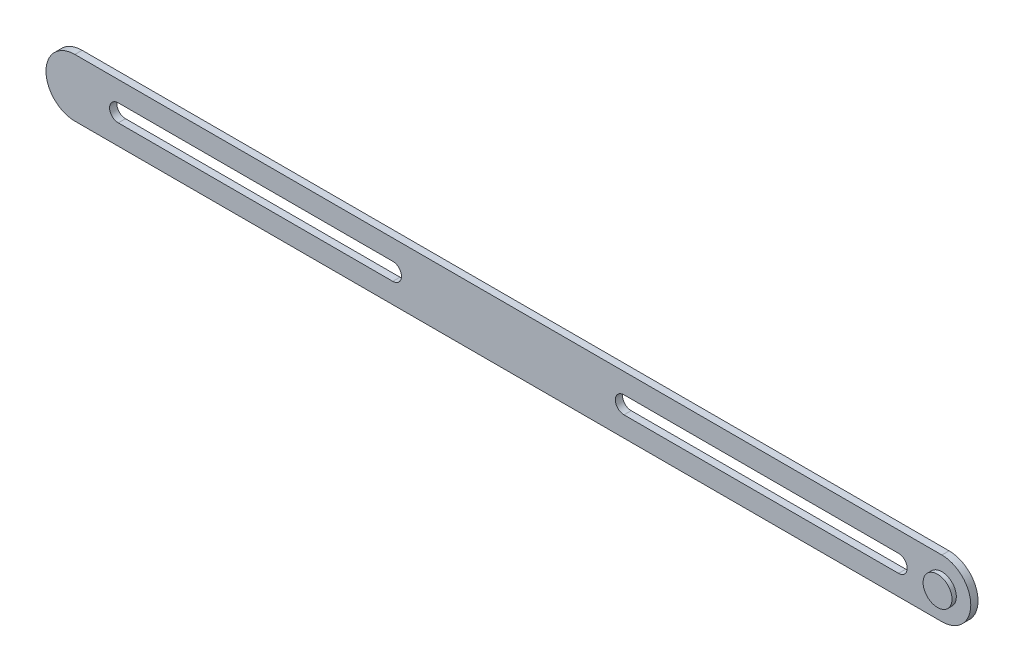
from build123d import *

# Parameters (mm, degrees)
SKETCH1_R                = 2.5
BOSS_EXTRUDE1_DEPTH      = 4
BOSS_EXTRUDE3_DEPTH      = 2.5
BOSS_EXTRUDE4_DEPTH      = 3.5
BOSS_EXTRUDE4_DEPTH_BACK = 4
SKETCH5_R                = 5


with BuildPart() as part:
    # Sketch1 → Boss-Extrude1 (new body)
    with BuildSketch(Plane.XY):
        Circle(SKETCH1_R)
    extrude(amount=BOSS_EXTRUDE1_DEPTH)

    # Sketch3 → Boss-Extrude3 (add)
    with BuildSketch(Plane.XY.offset(4)):
        with BuildLine():
            Line((0, 10), (300, 10))
            ThreePointArc((300, 10), (310, 0), (300, -10))
            Line((300, -10), (0, -10))
            ThreePointArc((0, -10), (-10, 0), (0, 10))
        make_face()
        with BuildLine():
            Line((15, 3), (110, 3))
            ThreePointArc((110, 3), (113, 0), (110, -3))
            Line((110, -3), (15, -3))
            ThreePointArc((15, -3), (12, 0), (15, 3))
        make_face(mode=Mode.SUBTRACT)
        with BuildLine():
            Line((285, 3), (190, 3))
            ThreePointArc((190, 3), (187, 0), (190, -3))
            Line((190, -3), (285, -3))
            ThreePointArc((285, -3), (288, 0), (285, 3))
        make_face(mode=Mode.SUBTRACT)
    extrude(amount=BOSS_EXTRUDE3_DEPTH)

    # Sketch5 → Boss-Extrude4 (add, two sides: drawn at the far end of the back side and taken through both)
    with BuildSketch(Plane(origin=(0, 0, 4), x_dir=(-1, 0, 0), z_dir=(0, 0, -1)).offset(-BOSS_EXTRUDE4_DEPTH_BACK)):
        with Locations((-300, 0)):
            Circle(SKETCH5_R)
    extrude(amount=BOSS_EXTRUDE4_DEPTH + BOSS_EXTRUDE4_DEPTH_BACK)


solid = part.part
